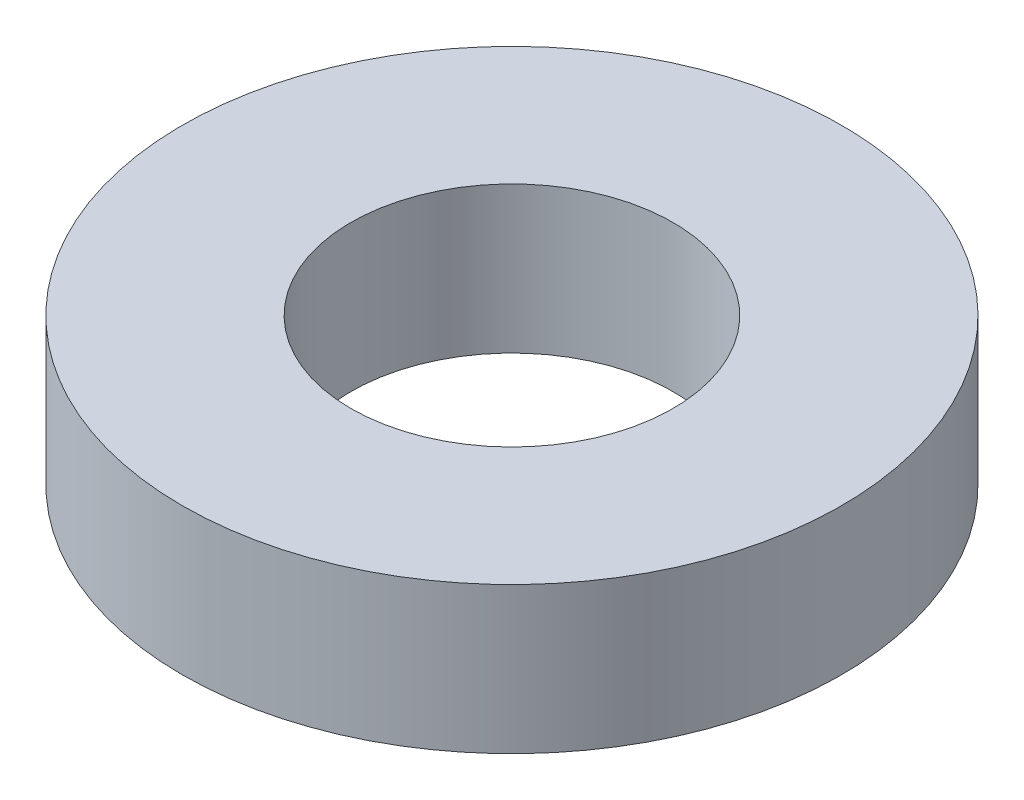
from build123d import *

# Parameters (mm, degrees)
SPACER_RING_SKETCH_R   = 4.5
SPACER_RING_SKETCH_R_2 = 2.2
SPACER_RING_DEPTH      = 2


with BuildPart() as part:
    # Spacer ring sketch → Spacer ring (new body)
    with BuildSketch(Plane(origin=(0, -62, 0), x_dir=(1, 0, 0), z_dir=(0, 1, 0))):
        with Locations(Location((-100.291651246, 25, 0), (0, 0, 270))):
            Circle(SPACER_RING_SKETCH_R)
        with Locations(Location((-100.291651246, 25, 0), (0, 0, 270))):
            Circle(SPACER_RING_SKETCH_R_2, mode=Mode.SUBTRACT)
    extrude(amount=SPACER_RING_DEPTH)


solid = part.part
